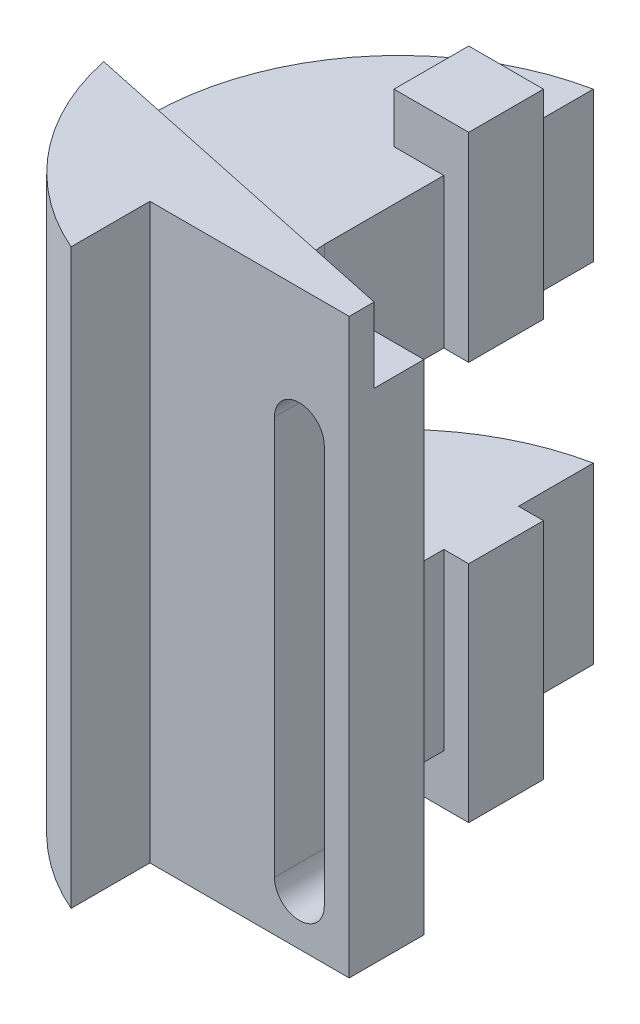
from build123d import *

# Parameters (mm, degrees)
BOSS_EXTRUDE1_DEPTH     = 125
CUT_EXTRUDE1_DEPTH      = 10
CUT_EXTRUDE2_START      = -5
CUT_EXTRUDE2_DEPTH      = 5
CUT_EXTRUDE3_START      = -10
CUT_EXTRUDE3_DEPTH      = 10
FILLET1_R               = 10
CUT_EXTRUDE5_DEPTH      = 154.180898585
CUT_EXTRUDE5_DEPTH_BACK = 154.180898585
SKETCH6_W               = 40
SKETCH6_H               = 35
BOSS_EXTRUDE2_DEPTH     = 15
CUT_EXTRUDE6_DEPTH      = 157.90664054
CUT_EXTRUDE6_DEPTH_BACK = 157.90664054
SKETCH8_R               = 5


with BuildPart() as part:
    # Sketch1 → Boss-Extrude1 (new body)
    with BuildSketch(Plane(origin=(0, 0, 0), x_dir=(1, 0, 0), z_dir=(0, 1, 0))):
        with BuildLine():
            Line((0, 0), (-40, 0))
            Line((-40, 0), (-40, -15.82575695))
            ThreePointArc((-40, -15.82575695), (-69.724211568, 35.244309675), (-30, 78.989794856))
            Line((-30, 78.989794856), (-30, 63.989794856))
            Line((-30, 63.989794856), (-25, 63.989794856))
            Line((-25, 63.989794856), (-25, 48.989794856))
            Line((-25, 48.989794856), (-30, 48.989794856))
            Line((-30, 48.989794856), (-30, 15))
            Line((-30, 15), (0, 15))
            Line((0, 15), (0, 0))
        make_face()
    extrude(amount=BOSS_EXTRUDE1_DEPTH)

    # Sketch2 → Cut-Extrude1 (cut)
    with BuildSketch(Plane.XZ):
        with BuildLine():
            Line((-30, -63.989794856), (-40, -63.989794856))
            Line((-40, -63.989794856), (-40, -48.989794856))
            Line((-40, -48.989794856), (-30, -48.989794856))
            Line((-30, -48.989794856), (-30, -15))
            Line((-30, -15), (0, -15))
            Line((0, -15), (0, 0))
            Line((0, 0), (-40, 0))
            Line((-40, 0), (-40, 15.82575695))
            ThreePointArc((-40, 15.82575695), (-69.724211568, -35.244309675), (-30, -78.989794856))
            Line((-30, -78.989794856), (-30, -63.989794856))
        make_face()
    extrude(amount=-CUT_EXTRUDE1_DEPTH, mode=Mode.SUBTRACT)

    # Sketch3 → Cut-Extrude2 (cut)
    with BuildSketch(Plane(origin=(0, 125, 0), x_dir=(1, 0, 0), z_dir=(0, 1, 0)).offset(CUT_EXTRUDE2_START)):
        with BuildLine():
            Line((0, 5), (-63.301270189, 5))
            ThreePointArc((-63.301270189, 5), (-65.594723232, 50.521238105), (-30, 78.989794856))
            Line((-30, 78.989794856), (-30, 63.989794856))
            Line((-30, 63.989794856), (-25, 63.989794856))
            Line((-25, 63.989794856), (-25, 48.989794856))
            Line((-25, 48.989794856), (-30, 48.989794856))
            Line((-30, 48.989794856), (-30, 15))
            Line((-30, 15), (0, 15))
            Line((0, 15), (0, 5))
        make_face()
    extrude(amount=CUT_EXTRUDE2_DEPTH, mode=Mode.SUBTRACT)

    # Sketch4 → Cut-Extrude3 (cut)
    with BuildSketch(Plane(origin=(0, 120, 0), x_dir=(1, 0, 0), z_dir=(0, 1, 0)).offset(CUT_EXTRUDE3_START)):
        with BuildLine():
            Line((-30, 63.989794856), (-40, 63.989794856))
            Line((-40, 63.989794856), (-40, 48.989794856))
            Line((-40, 48.989794856), (-30, 48.989794856))
            Line((-30, 48.989794856), (-30, 15))
            Line((-30, 15), (0, 15))
            Line((0, 15), (0, 5))
            Line((0, 5), (-63.301270189, 5))
            ThreePointArc((-63.301270189, 5), (-65.594723232, 50.521238105), (-30, 78.989794856))
            Line((-30, 78.989794856), (-30, 63.989794856))
        make_face()
    extrude(amount=CUT_EXTRUDE3_DEPTH, mode=Mode.SUBTRACT)

    # Fillet1
    fillet1_edges = [part.edges().sort_by_distance(p)[0] for p in [
        (-30, 60, -15),
    ]]
    fillet(fillet1_edges, radius=FILLET1_R)

    # Sketch6 → Cut-Extrude5 (cut, two sides: drawn at the far end of the back side and taken through both)
    with BuildSketch(Plane(origin=(-30, 0, 0), x_dir=(0, 0, -1), z_dir=(1, 0, 0)).offset(-CUT_EXTRUDE5_DEPTH_BACK)):
        with Locations((58.989794856, 62.5)):
            Rectangle(SKETCH6_W, SKETCH6_H)
    extrude(amount=CUT_EXTRUDE5_DEPTH + CUT_EXTRUDE5_DEPTH_BACK, mode=Mode.SUBTRACT)

    # Sketch7 → Boss-Extrude2 (add)
    with BuildSketch(Plane(origin=(0, 110, 0), x_dir=(1, 0, 0), z_dir=(0, 1, 0))):
        with BuildLine():
            Line((0, 5), (-68.916774738, 19.64871268))
            ThreePointArc((-68.916774738, 19.64871268), (-66.687130436, 12.102741784), (-63.301270189, 5))
            Line((-63.301270189, 5), (0, 5))
        make_face()
    extrude(amount=BOSS_EXTRUDE2_DEPTH)

    # Sketch8 → Cut-Extrude6 (cut, two sides: drawn at the far end of the back side and taken through both)
    with BuildSketch(Plane(origin=(0, 0, -15), x_dir=(-1, 0, 0), z_dir=(0, 0, -1)).offset(-CUT_EXTRUDE6_DEPTH_BACK)):
        with BuildLine():
            Line((15, 20), (15, 100))
            ThreePointArc((15, 100), (10, 95), (5, 100))
            Line((5, 100), (5, 20))
            ThreePointArc((5, 20), (10, 25), (15, 20))
        make_face()
        with Locations((10, 100)):
            Circle(SKETCH8_R)
        with Locations((10, 20)):
            Circle(SKETCH8_R)
    extrude(amount=CUT_EXTRUDE6_DEPTH + CUT_EXTRUDE6_DEPTH_BACK, mode=Mode.SUBTRACT)


solid = part.part
